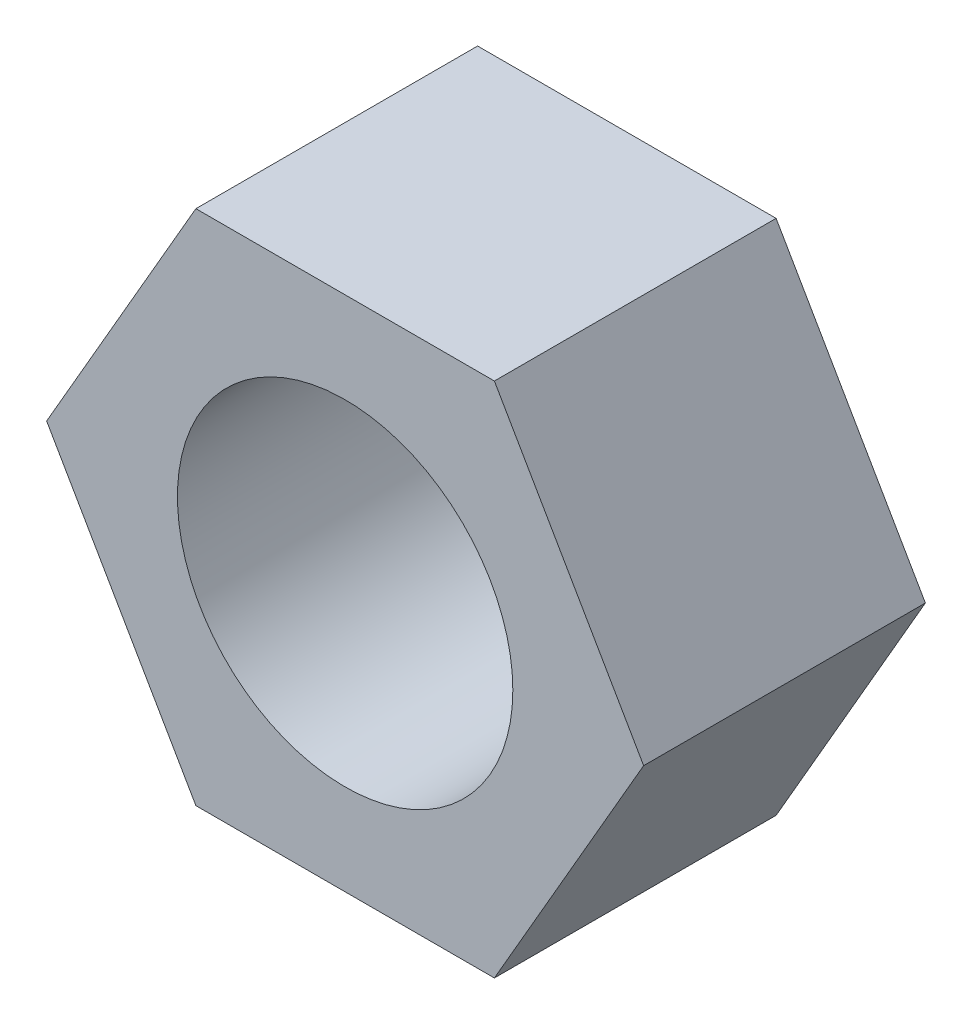
from build123d import *

# Parameters (mm, degrees)
BOSS_EXTRUDE1_DEPTH = 8.4
SKETCH2_R           = 5
CUT_EXTRUDE1_DEPTH  = 65


with BuildPart() as part:
    # Sketch1 → Boss-Extrude1 (new body)
    with BuildSketch(Plane.XY):
        Polygon((8.9, 0), (4.45, 7.707626094), (-4.45, 7.707626094), (-8.9, 0), (-4.45, -7.707626094), (4.45, -7.707626094), align=None)
    extrude(amount=BOSS_EXTRUDE1_DEPTH)

    # Sketch2 → Cut-Extrude1 (cut)
    with BuildSketch(Plane.XY.offset(8.4)):
        Circle(SKETCH2_R)
    extrude(amount=-CUT_EXTRUDE1_DEPTH, mode=Mode.SUBTRACT)


solid = part.part
